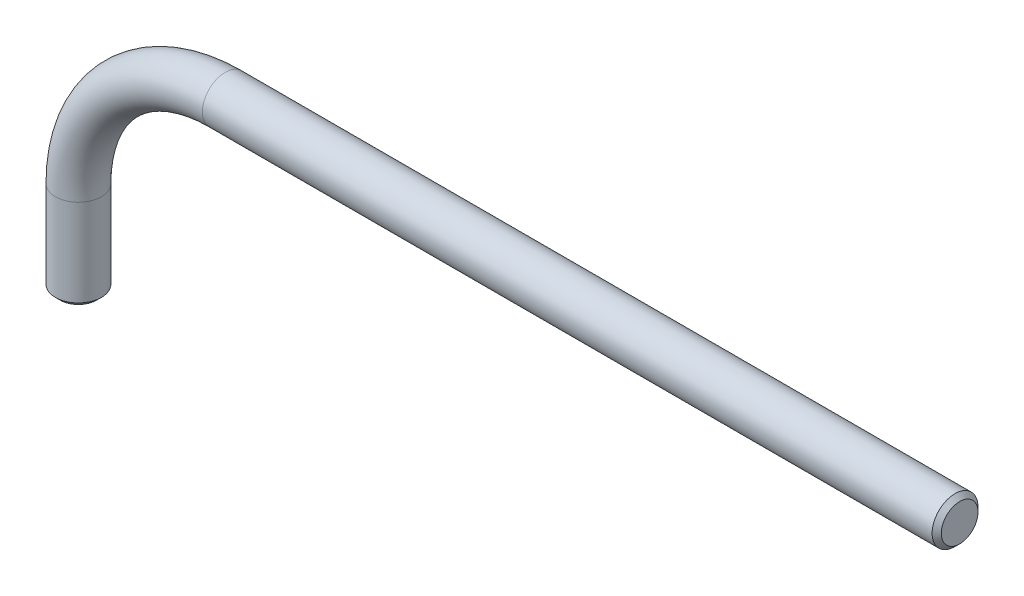
from build123d import *

# Parameters (mm, degrees)
SKETCH1_R     = 2.5
CHAMFER1_SIZE = 0.5


with BuildPart() as part:
    # Sweep1: sweep along a path in Sketch2
    with BuildLine(Plane.XY) as sweep1_path:
        Line((0, 0), (0, 10))
        ThreePointArc((0, 10), (4.686291501, 21.313708499), (16, 26))
        Line((16, 26), (96, 26))
    # Sketch1 → Sweep1 (sweep)
    with BuildSketch(Plane(origin=(0, 0, 0), x_dir=(1, 0, 0), z_dir=(0, 1, 0))):
        Circle(SKETCH1_R)
    sweep(path=sweep1_path.line)

    # Chamfer1
    chamfer1_edges = [part.edges().sort_by_distance(p)[0] for p in [
        (96, 28.5, 0),
        (-2.5, 0, 0),
    ]]
    chamfer(chamfer1_edges, length=CHAMFER1_SIZE)


solid = part.part
